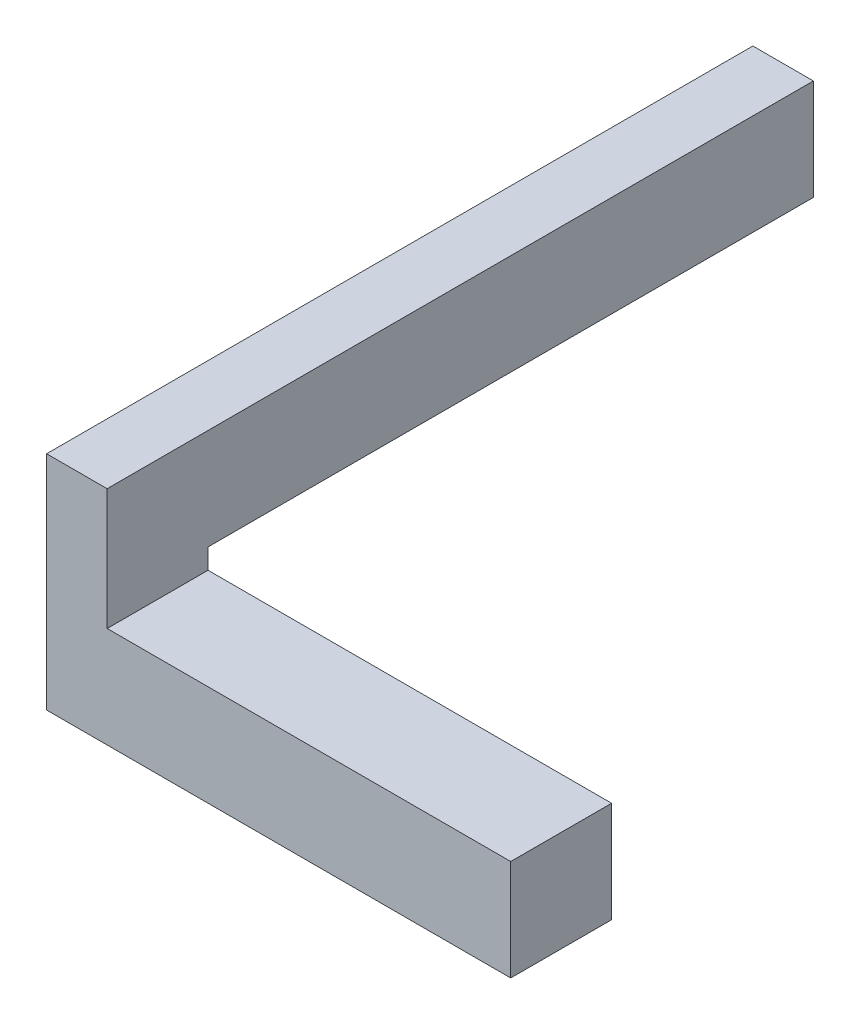
from build123d import *

# Parameters (mm, degrees)
SKETCH1_W           = 6
SKETCH1_H           = 10
BOSS_EXTRUDE1_DEPTH = 70
SKETCH2_W           = 6
SKETCH2_H           = 10
BOSS_EXTRUDE2_DEPTH = 12
SKETCH3_W           = 10
SKETCH3_H           = 10
BOSS_EXTRUDE3_DEPTH = 40


with BuildPart() as part:
    # Sketch1 → Boss-Extrude1 (new body)
    with BuildSketch(Plane.XY):
        Rectangle(SKETCH1_W, SKETCH1_H)
    extrude(amount=BOSS_EXTRUDE1_DEPTH)

    # Sketch2 → Boss-Extrude2 (add)
    with BuildSketch(Plane.XZ.offset(5)):
        with Locations((0, 65)):
            Rectangle(SKETCH2_W, SKETCH2_H)
    extrude(amount=BOSS_EXTRUDE2_DEPTH)

    # Sketch3 → Boss-Extrude3 (add)
    with BuildSketch(Plane(origin=(3, 0, 0), x_dir=(0, 0, -1), z_dir=(1, 0, 0))):
        with Locations((-65, -12)):
            Rectangle(SKETCH3_W, SKETCH3_H)
    extrude(amount=BOSS_EXTRUDE3_DEPTH)


solid = part.part
